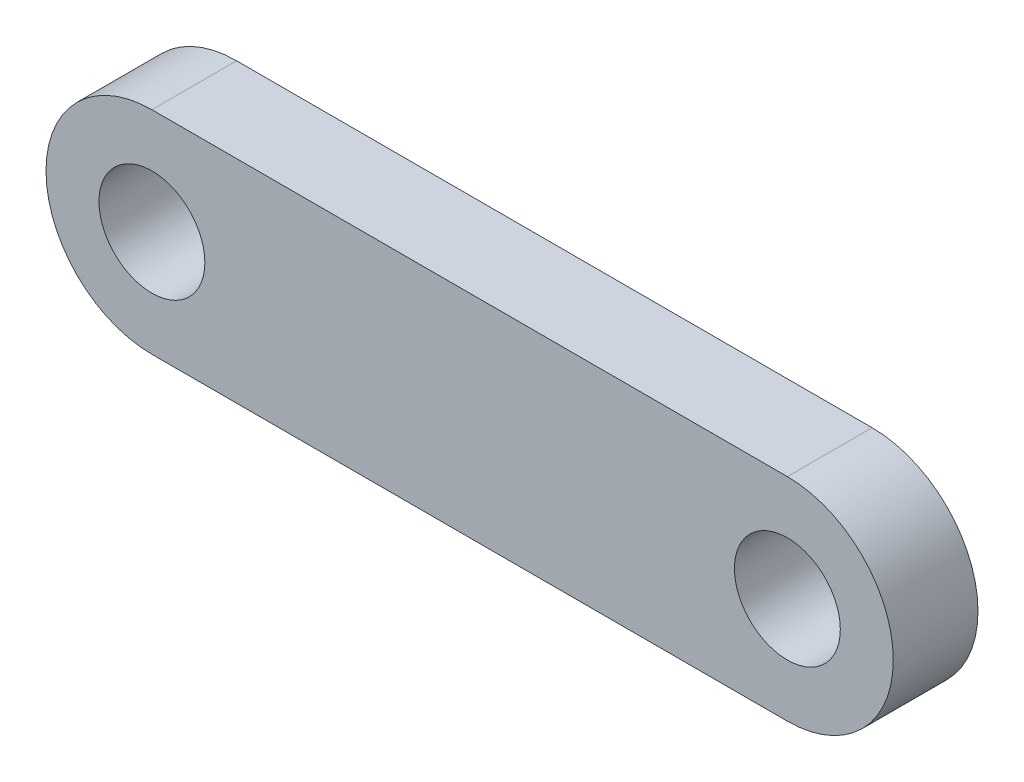
from build123d import *

# Parameters (mm, degrees)
ESQUISSE1_R        = 2.5
BOSS_EXTRU_1_DEPTH = 4


with BuildPart() as part:
    # Esquisse1 → Boss.-Extru.1 (new body)
    with BuildSketch(Plane.XY):
        with BuildLine():
            Line((0, 5), (30, 5))
            ThreePointArc((30, 5), (35, 0), (30, -5))
            Line((30, -5), (0, -5))
            ThreePointArc((0, -5), (-5, 0), (0, 5))
        make_face()
        with Locations((30, 0)):
            Circle(ESQUISSE1_R, mode=Mode.SUBTRACT)
        Circle(ESQUISSE1_R, mode=Mode.SUBTRACT)
    extrude(amount=BOSS_EXTRU_1_DEPTH)


solid = part.part
